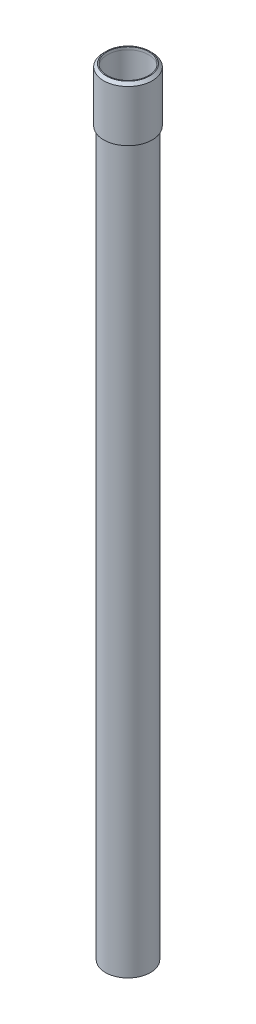
from build123d import *

# Parameters (mm, degrees)
SKETCH1_R      = 12.5
SKETCH1_R_2    = 11.5
EXTRUDE1_DEPTH = 215
CHAMFER1_SIZE  = 1.5


with BuildPart() as part:
    # Sketch1 → Extrude1 (new, symmetric)
    with BuildSketch(Plane(origin=(0, 0, 0), x_dir=(1, 0, 0), z_dir=(0, 1, 0))):
        with Locations(Location((0, 0, 0), (0, 0, 270))):
            Circle(SKETCH1_R)
        with Locations(Location((0, 0, 0), (0, 0, 270))):
            Circle(SKETCH1_R_2, mode=Mode.SUBTRACT)
    extrude(amount=EXTRUDE1_DEPTH, both=True)


with BuildPart() as body_2:
    # Sketch2 → Revolve1 (revolve)
    with BuildSketch(Plane.XY, mode=Mode.PRIVATE) as revolve1_sk:
        Polygon((13.5, 216.5), (13.5, 186.5), (12.5, 186.5), (12.5, 215), (11.5, 215), (11.5, 216.5), align=None)
    revolve(revolve1_sk.sketch.rotate(Axis((0, 224.324804611, 0), (0, -1, 0)), 90), axis=Axis((0, 224.324804611, 0), (0, -1, 0)))

    # Chamfer1
    chamfer1_edges = [body_2.edges().sort_by_distance(p)[0] for p in [
        (0, 216.5, -13.5),
    ]]
    chamfer(chamfer1_edges, length=CHAMFER1_SIZE)


solid = Compound([part.part, body_2.part])
